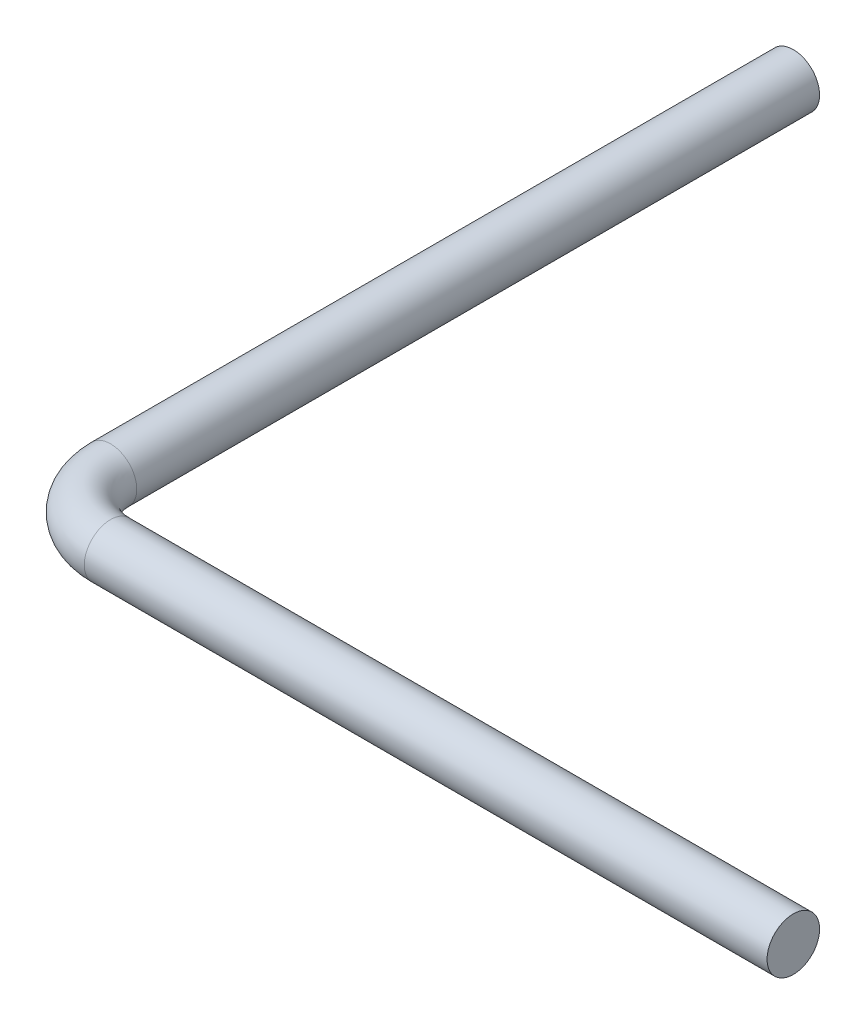
from build123d import *

# Parameters (mm, degrees)
SKETCH_1_R      = 2
EXTRUDE_1_DEPTH = 50
SKETCH_3_R      = 2


with BuildPart() as part:
    # ｽｹｯﾁ1 → ﾎﾞｽ - 押し出し1 (new body)
    with BuildSketch(Plane.XY):
        Circle(SKETCH_1_R)
    extrude(amount=EXTRUDE_1_DEPTH)

    # ｽｲｰﾌﾟ1: sweep along a path in ｽｹｯﾁ2
    with BuildLine(Plane(origin=(0, 0, 0), x_dir=(1, 0, 0), z_dir=(0, 1, 0))) as sweep_1_path:
        Line((0, -50), (0, -52))
        ThreePointArc((0, -52), (1.464466094, -55.535533906), (5, -57))
        Line((5, -57), (57, -57))
    # ｽｹｯﾁ3 → ｽｲｰﾌﾟ1 (sweep)
    with BuildSketch(Plane.XY.offset(50)):
        Circle(SKETCH_3_R)
    sweep(path=sweep_1_path.line)


solid = part.part
